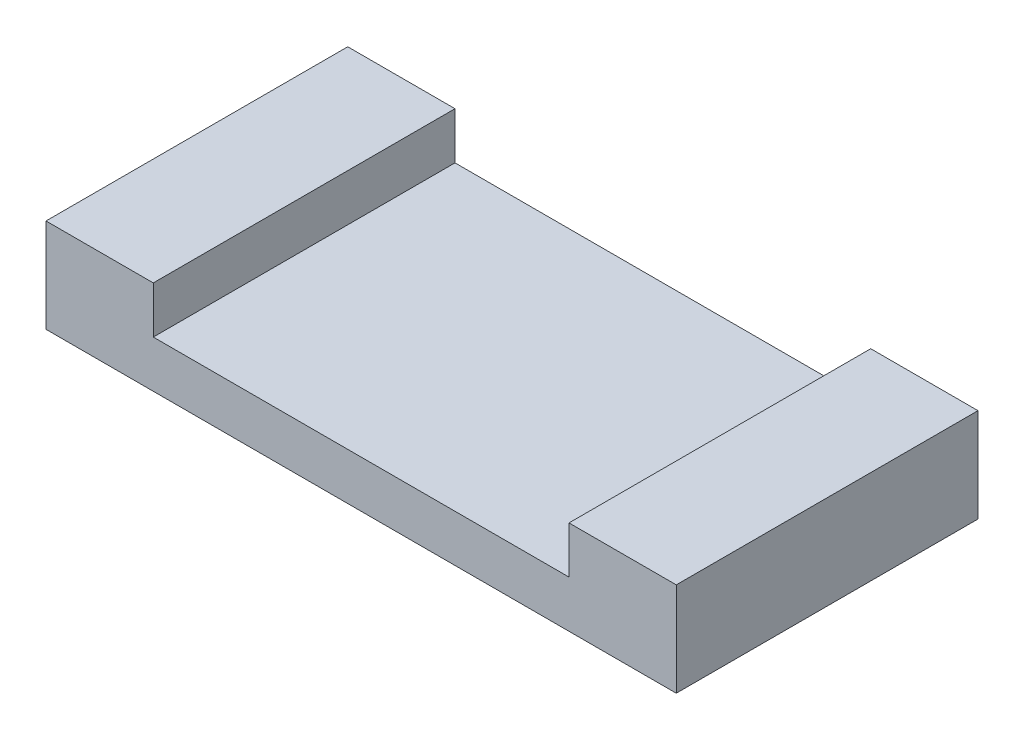
from build123d import *

# Parameters (mm, degrees)
SKETCH1_W           = 47
SKETCH1_H           = 22.5
BOSS_EXTRUDE1_DEPTH = 2
BOSS_EXTRUDE2_DEPTH = 22.5


with BuildPart() as part:
    # Sketch1 → Boss-Extrude1 (new body)
    with BuildSketch(Plane(origin=(0, 0, 0), x_dir=(1, 0, 0), z_dir=(0, 1, 0))):
        Rectangle(SKETCH1_W, SKETCH1_H)
    extrude(amount=-BOSS_EXTRUDE1_DEPTH)

    # Sketch2 → Boss-Extrude2 (add)
    with BuildSketch(Plane.XY.offset(11.25)):
        Polygon((-23.5, 0), (23.5, 0), (23.5, 5), (15.5, 5), (15.5, 1.501741003), (-15.5, 1.501741003), (-15.5, 5), (-23.5, 5), align=None)
    extrude(amount=-BOSS_EXTRUDE2_DEPTH)


solid = part.part
